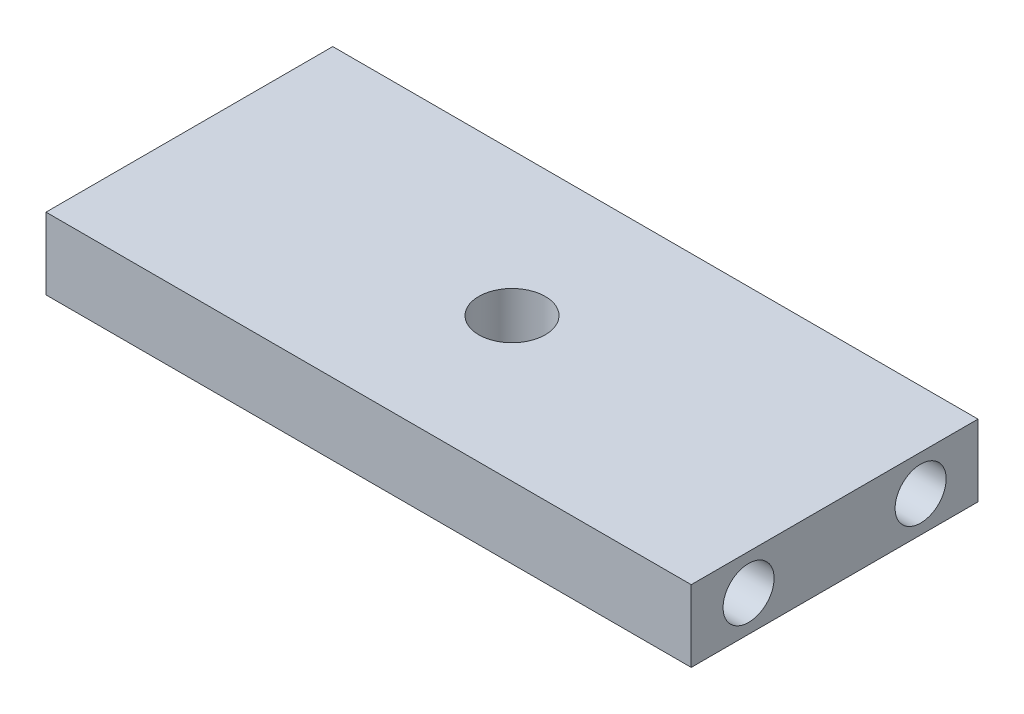
from build123d import *

# Parameters (mm, degrees)
SKETCH1_W                 = 12.7
SKETCH1_H                 = 3.175
BOSS_EXTRUDE1_DEPTH       = 28.575
F_4_CLEARANCE_HOLE1_D     = 2.9464
F_4_CLEARANCE_HOLE1_DEPTH = 3.302
F_4_CLEARANCE_HOLE1_TIP   = 0.885187864
F_4_40_TAPPED_HOLE1_D     = 2.2606
F_4_40_TAPPED_HOLE1_DEPTH = 7.62
F_4_40_TAPPED_HOLE1_TIP   = 0.679152758
F_4_40_TAPPED_HOLE2_D     = 2.2606
F_4_40_TAPPED_HOLE2_DEPTH = 7.62
F_4_40_TAPPED_HOLE2_TIP   = 0.679152758


with BuildPart() as part:
    # Sketch1 → Boss-Extrude1 (new body)
    with BuildSketch(Plane(origin=(0, 0, 0), x_dir=(0, 0, -1), z_dir=(1, 0, 0))):
        Rectangle(SKETCH1_W, SKETCH1_H)
    extrude(amount=BOSS_EXTRUDE1_DEPTH)

    # #4 Clearance Hole1
    with Locations(Plane(origin=(0, 1.5875, 0), x_dir=(1, 0, 0), z_dir=(0, 1, 0))):
        with Locations((14.2875, 0)):
            Hole(F_4_CLEARANCE_HOLE1_D / 2, depth=F_4_CLEARANCE_HOLE1_DEPTH)
            with Locations((0, 0, -(F_4_CLEARANCE_HOLE1_DEPTH + F_4_CLEARANCE_HOLE1_TIP / 2))):  # 118° drill point
                Cone(0, F_4_CLEARANCE_HOLE1_D / 2, F_4_CLEARANCE_HOLE1_TIP, mode=Mode.SUBTRACT)

    # #4-40 Tapped Hole1
    with Locations(Plane.ZY):
        with Locations((-3.81, 0), (3.81, 0)):
            Hole(F_4_40_TAPPED_HOLE1_D / 2, depth=F_4_40_TAPPED_HOLE1_DEPTH)
            with Locations((0, 0, -(F_4_40_TAPPED_HOLE1_DEPTH + F_4_40_TAPPED_HOLE1_TIP / 2))):  # 118° drill point
                Cone(0, F_4_40_TAPPED_HOLE1_D / 2, F_4_40_TAPPED_HOLE1_TIP, mode=Mode.SUBTRACT)

    # #4-40 Tapped Hole2
    with Locations(Plane(origin=(28.575, 0, 0), x_dir=(0, 0, -1), z_dir=(1, 0, 0))):
        with Locations((-3.81, 0), (3.81, 0)):
            Hole(F_4_40_TAPPED_HOLE2_D / 2, depth=F_4_40_TAPPED_HOLE2_DEPTH)
            with Locations((0, 0, -(F_4_40_TAPPED_HOLE2_DEPTH + F_4_40_TAPPED_HOLE2_TIP / 2))):  # 118° drill point
                Cone(0, F_4_40_TAPPED_HOLE2_D / 2, F_4_40_TAPPED_HOLE2_TIP, mode=Mode.SUBTRACT)


solid = part.part
